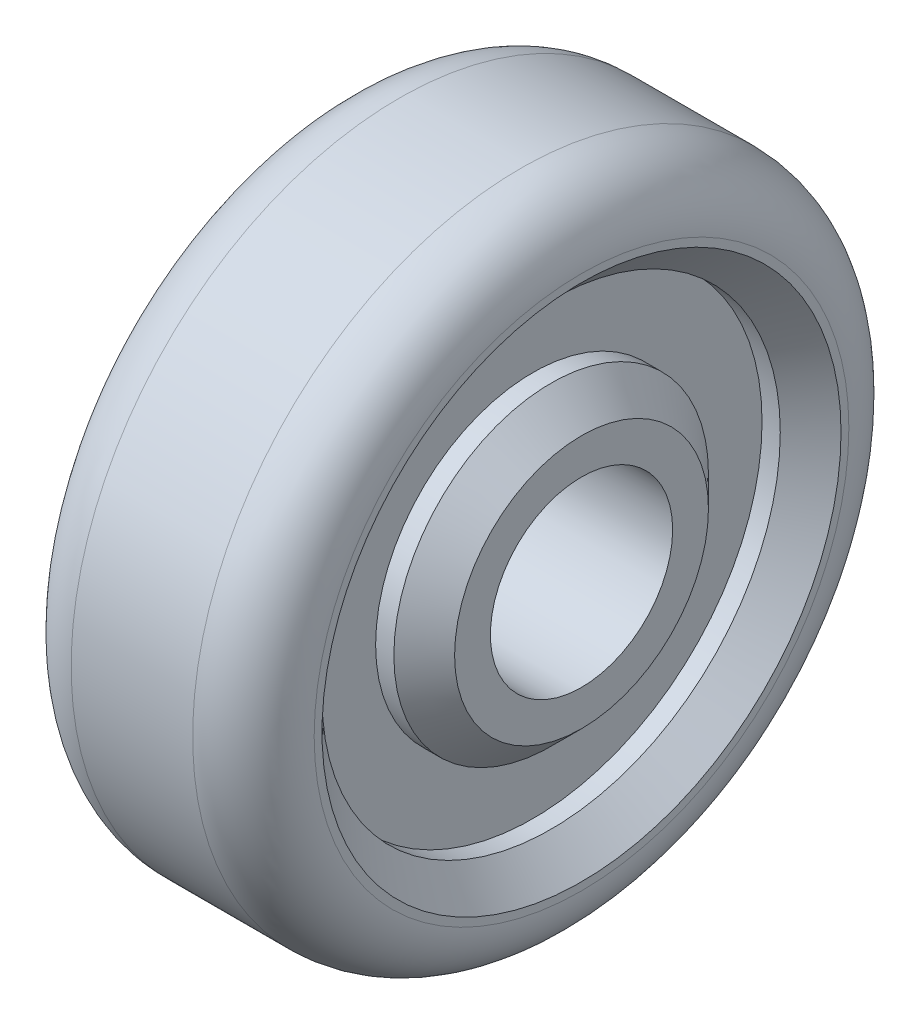
from build123d import *

# Parameters (mm, degrees)
SKETCH_1_R                 = 54
SKETCH_1_R_2               = 15
EXTRUDE_1_DEPTH            = 20
FILLET_1_R                 = 10
SKETCH_2_R                 = 37.711489045
SKETCH_2_R_2               = 25.889208159
CUT_EXTRUDE_1_DEPTH        = 8
CHAMFER_1_SIZE             = 5
CHAMFER_1_OF_MIRROR_4_SIZE = 5


with BuildPart() as part:
    # 草图1 → 凸台-拉伸1 (new, symmetric)
    with BuildSketch(Plane(origin=(0, 0, 0), x_dir=(0, 0, -1), z_dir=(1, 0, 0))):
        Circle(SKETCH_1_R)
        Circle(SKETCH_1_R_2, mode=Mode.SUBTRACT)
    extrude(amount=EXTRUDE_1_DEPTH, both=True)

    # 圆角1
    fillet_1_edges = [part.edges().sort_by_distance(p)[0] for p in [
        (-20, 0, 54),
        (20, 0, 54),
    ]]
    fillet(fillet_1_edges, radius=FILLET_1_R)

    # 草图2 → 切除-拉伸1 (cut)
    with BuildSketch(Plane(origin=(20, 0, 0), x_dir=(0, 0, -1), z_dir=(1, 0, 0))):
        Circle(SKETCH_2_R)
        Circle(SKETCH_2_R_2, mode=Mode.SUBTRACT)
    cut_extrude_1 = extrude(amount=-CUT_EXTRUDE_1_DEPTH, mode=Mode.SUBTRACT)

    # 倒角1
    chamfer_1_edges = [part.edges().sort_by_distance(p)[0] for p in [
        (20, 0, 37.711489045),
        (20, 0, 25.889208159),
    ]]
    chamfer(chamfer_1_edges, length=CHAMFER_1_SIZE)

    # 镜向4: 切除-拉伸1 across plane
    add(cut_extrude_1.mirror(Plane(origin=(0, 0, 0), x_dir=(0, 0, 1), z_dir=(1, 0, 0))), mode=Mode.SUBTRACT)

    # 倒角1 of 镜向4
    chamfer_1_of_mirror_4_edges = [part.edges().sort_by_distance(p)[0] for p in [
        (-20, 0, 37.711489045),
        (-20, 0, 25.889208159),
    ]]
    chamfer(chamfer_1_of_mirror_4_edges, length=CHAMFER_1_OF_MIRROR_4_SIZE)


solid = part.part
